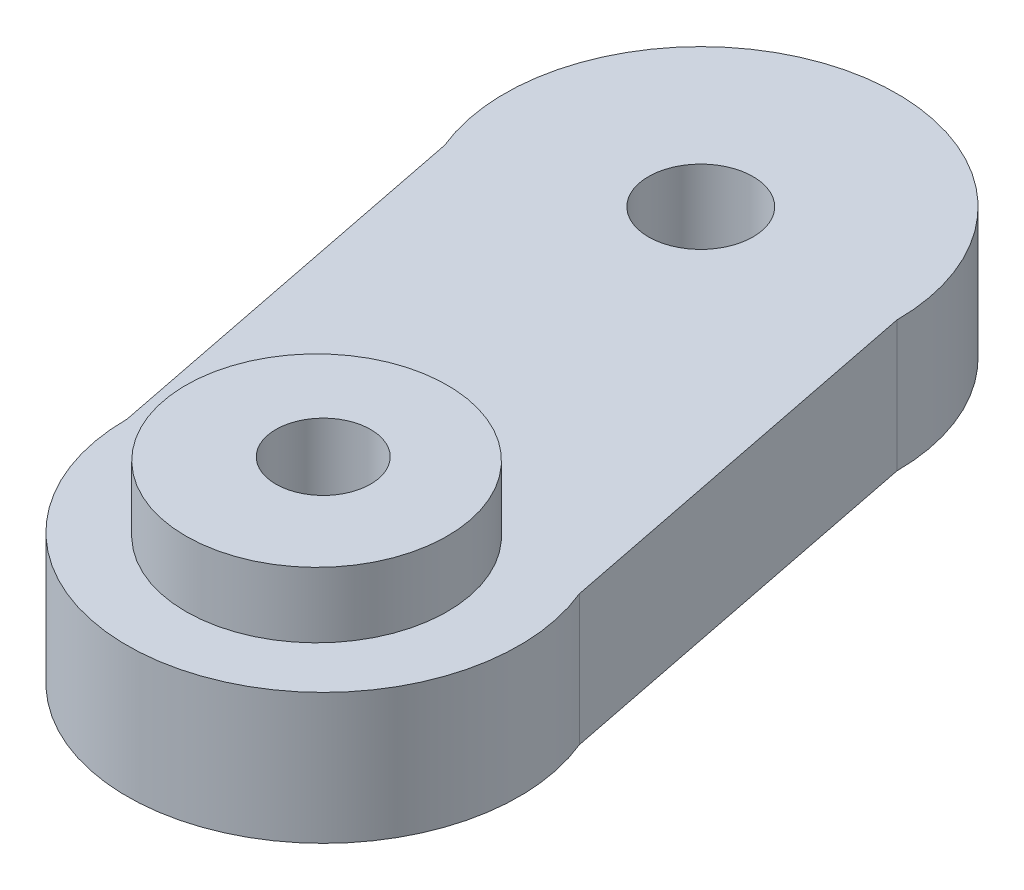
from build123d import *

# Parameters (mm, degrees)
SKETCH1_R           = 1.6
SKETCH1_R_2         = 1.45
BOSS_EXTRUDE1_DEPTH = 4
SKETCH2_R           = 4
SKETCH2_R_2         = 1.45
BOSS_EXTRUDE2_DEPTH = 2


with BuildPart() as part:
    # Sketch1 → Boss-Extrude1 (new body)
    with BuildSketch(Plane(origin=(0, 0, 0), x_dir=(1, 0, 0), z_dir=(0, 1, 0))):
        with BuildLine():
            Line((-5.547666284, -2.285475619), (-3.15, -14.4))
            ThreePointArc((-3.15, -14.4), (4.014903922, -20.285830345), (8.397666284, -12.114524381))
            Line((8.397666284, -12.114524381), (6, 0))
            ThreePointArc((6, 0), (-1.164903922, 5.885830345), (-5.547666284, -2.285475619))
        make_face()
        with Locations(Location((0, 0, 0), (0, 0, 270))):
            Circle(SKETCH1_R, mode=Mode.SUBTRACT)
        with Locations(Location((2.85, -14.4, 0), (0, 0, 270))):
            Circle(SKETCH1_R_2, mode=Mode.SUBTRACT)
    extrude(amount=BOSS_EXTRUDE1_DEPTH)

    # Sketch2 → Boss-Extrude2 (add)
    with BuildSketch(Plane(origin=(0, 4, 0), x_dir=(1, 0, 0), z_dir=(0, 1, 0))):
        with Locations(Location((2.85, -14.602637459, 0), (0, 0, 270))):
            Circle(SKETCH2_R)
        with Locations(Location((2.85, -14.4, 0), (0, 0, 270))):
            Circle(SKETCH2_R_2, mode=Mode.SUBTRACT)
    extrude(amount=BOSS_EXTRUDE2_DEPTH)


solid = part.part
